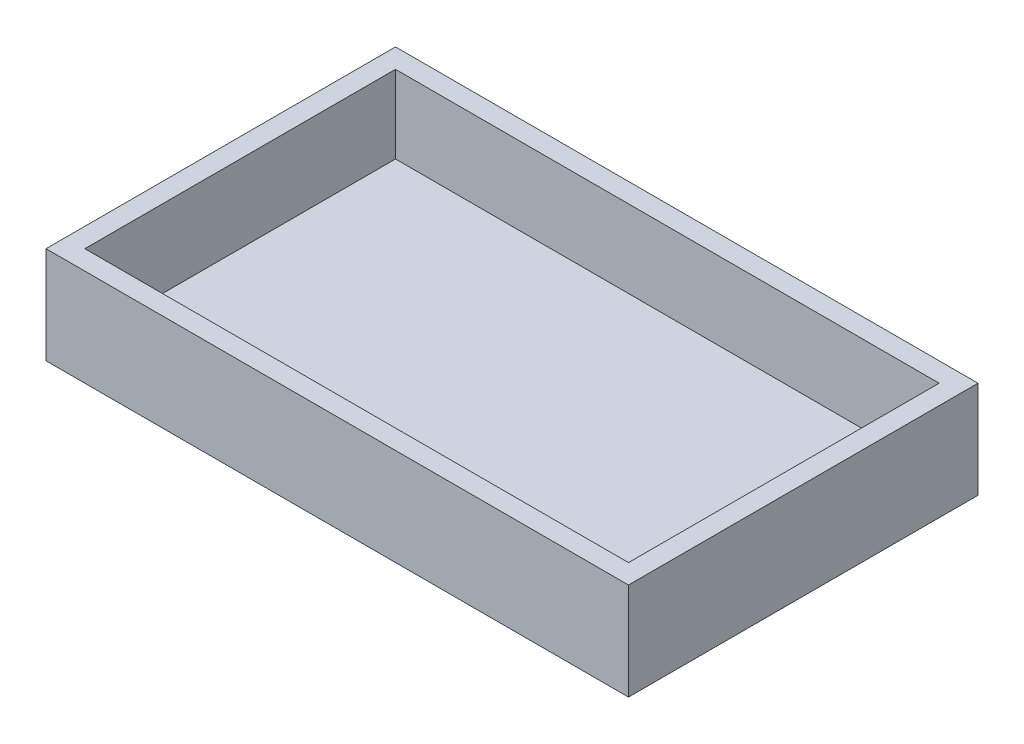
from build123d import *

# Parameters (mm, degrees)
SKETCH1_W           = 300
SKETCH1_H           = 180
BOSS_EXTRUDE1_DEPTH = 50
SKETCH2_W           = 280
SKETCH2_H           = 160
CUT_EXTRUDE1_DEPTH  = 40


with BuildPart() as part:
    # Sketch1 → Boss-Extrude1 (new body)
    with BuildSketch(Plane(origin=(0, 0, 0), x_dir=(1, 0, 0), z_dir=(0, 1, 0))):
        Rectangle(SKETCH1_W, SKETCH1_H)
    extrude(amount=BOSS_EXTRUDE1_DEPTH)

    # Sketch2 → Cut-Extrude1 (cut)
    with BuildSketch(Plane(origin=(0, 50, 0), x_dir=(1, 0, 0), z_dir=(0, 1, 0))):
        Rectangle(SKETCH2_W, SKETCH2_H)
    extrude(amount=-CUT_EXTRUDE1_DEPTH, mode=Mode.SUBTRACT)


solid = part.part
